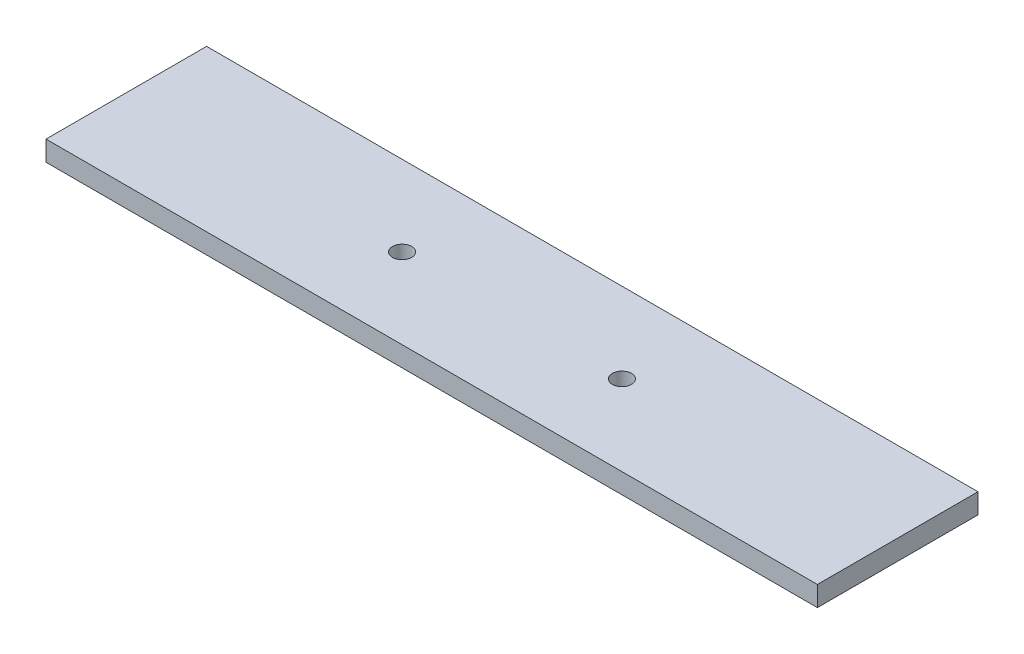
from build123d import *

# Parameters (mm, degrees)
SKETCH1_W           = 244
SKETCH1_H           = 50.8
BOSS_EXTRUDE1_DEPTH = 6.35
SKETCH2_R           = 3.0226
CUT_EXTRUDE1_DEPTH  = 6.35


with BuildPart() as part:
    # Sketch1 → Boss-Extrude1 (new body)
    with BuildSketch(Plane(origin=(0, 0, 0), x_dir=(1, 0, 0), z_dir=(0, 1, 0))):
        Rectangle(SKETCH1_W, SKETCH1_H)
    extrude(amount=BOSS_EXTRUDE1_DEPTH)

    # Sketch2 → Cut-Extrude1 (cut)
    with BuildSketch(Plane(origin=(0, 6.35, 0), x_dir=(1, 0, 0), z_dir=(0, 1, 0))):
        with Locations(Location((-34.7726, 0, 0), (0, 0, 270))):
            Circle(SKETCH2_R)
        with Locations(Location((34.7726, 0, 0), (0, 0, 90))):
            Circle(SKETCH2_R)
    extrude(amount=-CUT_EXTRUDE1_DEPTH, mode=Mode.SUBTRACT)


solid = part.part
